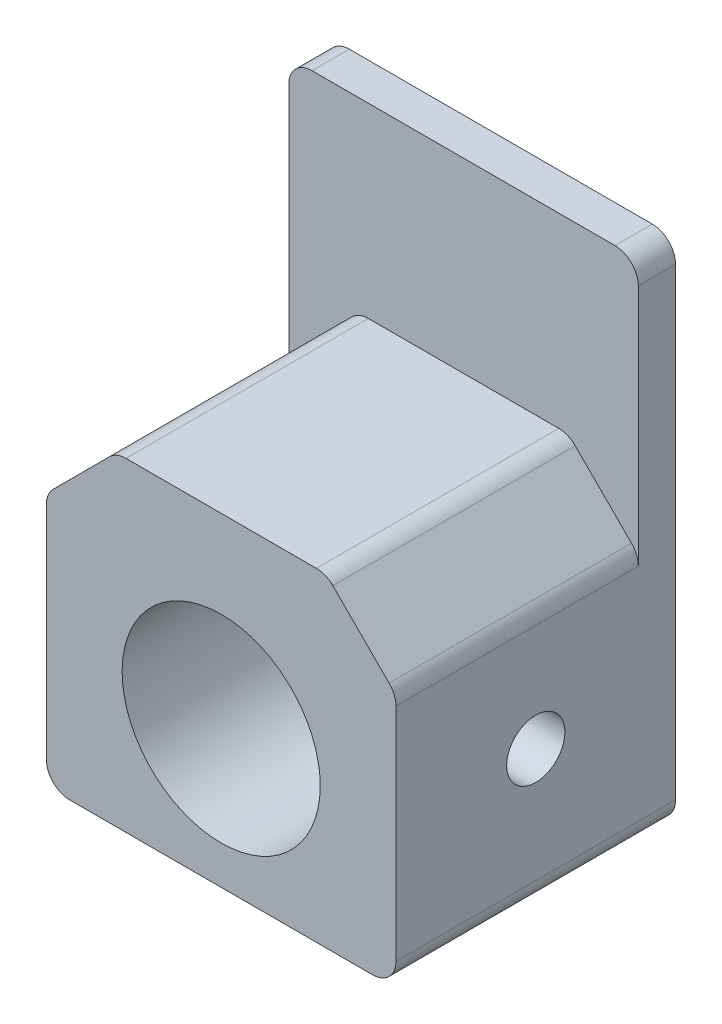
from build123d import *

# Parameters (mm, degrees)
SKETCH1_R           = 4.25
BOSS_EXTRUDE1_DEPTH = 1.6
SKETCH2_R           = 4.25
BOSS_EXTRUDE2_DEPTH = 10.4
FILLET1_R           = 1
SKETCH3_R           = 1.25
CUT_EXTRUDE1_DEPTH  = 23.111139726


with BuildPart() as part:
    # Sketch1 → Boss-Extrude1 (new body)
    with BuildSketch(Plane.XY):
        with BuildLine():
            Line((6.5, 10.95), (-6.5, 10.95))
            ThreePointArc((-6.5, 10.95), (-7.207106781, 10.657106781), (-7.5, 9.95))
            Line((-7.5, 9.95), (-7.5, -9.95))
            ThreePointArc((-7.5, -9.95), (-7.207106781, -10.657106781), (-6.5, -10.95))
            Line((-6.5, -10.95), (6.5, -10.95))
            ThreePointArc((6.5, -10.95), (7.207106781, -10.657106781), (7.5, -9.95))
            Line((7.5, -9.95), (7.5, 9.95))
            ThreePointArc((7.5, 9.95), (7.207106781, 10.657106781), (6.5, 10.95))
        make_face()
        with Locations((0, -5.05)):
            Circle(SKETCH1_R, mode=Mode.SUBTRACT)
    extrude(amount=BOSS_EXTRUDE1_DEPTH)

    # Sketch2 → Boss-Extrude2 (add)
    with BuildSketch(Plane.XY.offset(1.6)):
        with BuildLine():
            Line((-4.5, 2.95), (4.5, 2.95))
            Line((4.5, 2.95), (7.5, -0.05))
            Line((7.5, -0.05), (7.5, -9.95))
            ThreePointArc((7.5, -9.95), (7.207106781, -10.657106781), (6.5, -10.95))
            Line((6.5, -10.95), (-6.5, -10.95))
            ThreePointArc((-6.5, -10.95), (-7.207106781, -10.657106781), (-7.5, -9.95))
            Line((-7.5, -9.95), (-7.5, -0.05))
            Line((-7.5, -0.05), (-4.5, 2.95))
        make_face()
        with Locations((0, -5.05)):
            Circle(SKETCH2_R, mode=Mode.SUBTRACT)
    extrude(amount=BOSS_EXTRUDE2_DEPTH)

    # Fillet1
    fillet1_edges = [part.edges().sort_by_distance(p)[0] for p in [
        (-7.5, -0.05, 6.8),
        (7.5, -0.05, 6.8),
        (4.5, 2.95, 6.8),
        (-4.5, 2.95, 6.8),
    ]]
    fillet(fillet1_edges, radius=FILLET1_R)

    # Sketch3 → Cut-Extrude1 (cut, through all)
    with BuildSketch(Plane(origin=(7.5, 0, 0), x_dir=(0, 0, -1), z_dir=(1, 0, 0))):
        with Locations(Location((-6, -5.05, 0), (0, 0, 90))):
            Circle(SKETCH3_R)
    extrude(amount=-CUT_EXTRUDE1_DEPTH, mode=Mode.SUBTRACT)


solid = part.part
